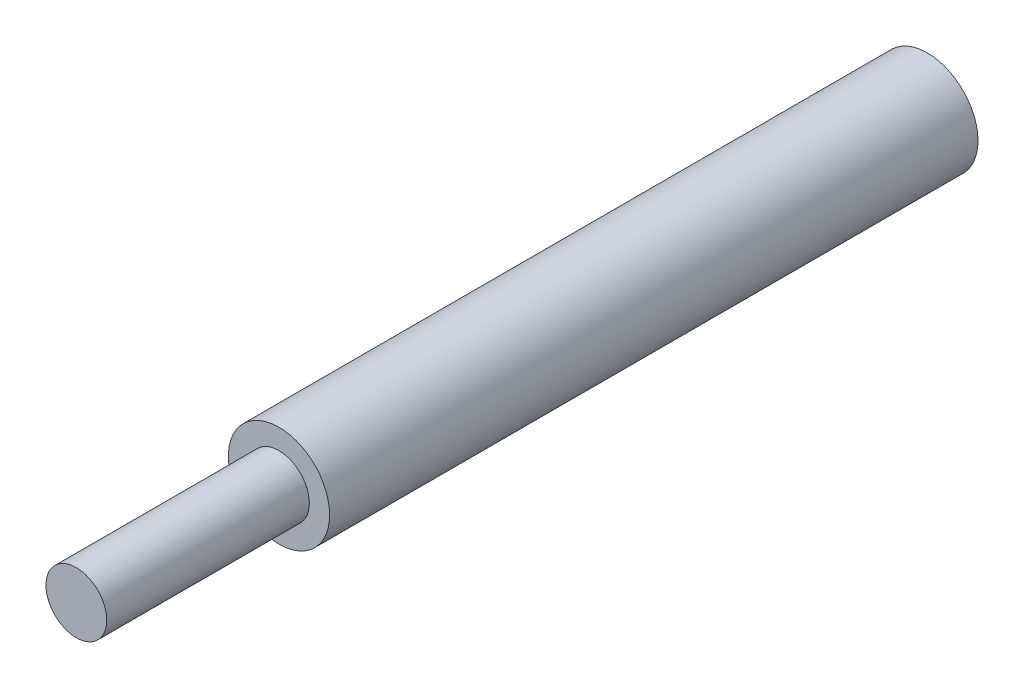
from build123d import *

# Parameters (mm, degrees)
SKETCH1_R           = 12.5
BOSS_EXTRUDE1_DEPTH = 80
SKETCH2_R           = 7.5
BOSS_EXTRUDE2_DEPTH = 50


with BuildPart() as part:
    # Sketch1 → Boss-Extrude1 (new, symmetric)
    with BuildSketch(Plane.XY):
        Circle(SKETCH1_R)
    extrude(amount=BOSS_EXTRUDE1_DEPTH, both=True)

    # Sketch2 → Boss-Extrude2 (add)
    with BuildSketch(Plane.XY.offset(80)):
        Circle(SKETCH2_R)
    extrude(amount=BOSS_EXTRUDE2_DEPTH)


solid = part.part
